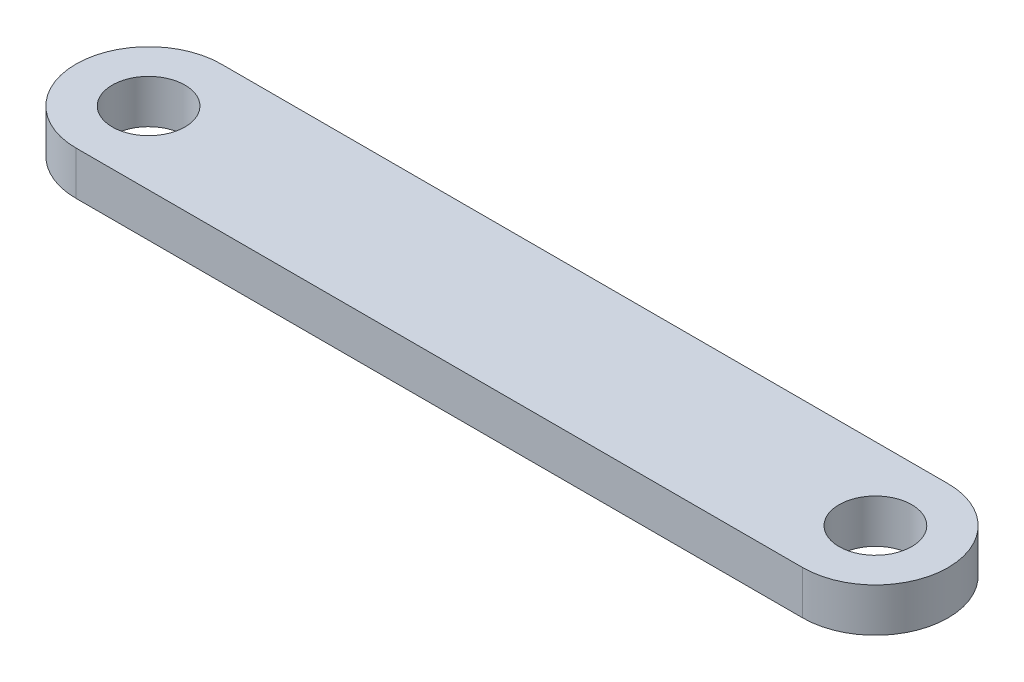
from build123d import *

# Parameters (mm, degrees)
CROQUIS1_R              = 2.5
SALIENTE_EXTRUIR1_DEPTH = 3


with BuildPart() as part:
    # Croquis1 → Saliente-Extruir1 (new body)
    with BuildSketch(Plane(origin=(0, 0, 0), x_dir=(1, 0, 0), z_dir=(0, 1, 0))):
        with BuildLine():
            Line((-25, 5), (25, 5))
            ThreePointArc((25, 5), (30, 0), (25, -5))
            Line((25, -5), (-25, -5))
            ThreePointArc((-25, -5), (-30, 0), (-25, 5))
        make_face()
        with Locations(Location((-25, 0, 0), (0, 0, 270))):
            Circle(CROQUIS1_R, mode=Mode.SUBTRACT)
        with Locations(Location((25, 0, 0), (0, 0, 270))):
            Circle(CROQUIS1_R, mode=Mode.SUBTRACT)
    extrude(amount=SALIENTE_EXTRUIR1_DEPTH)


solid = part.part
